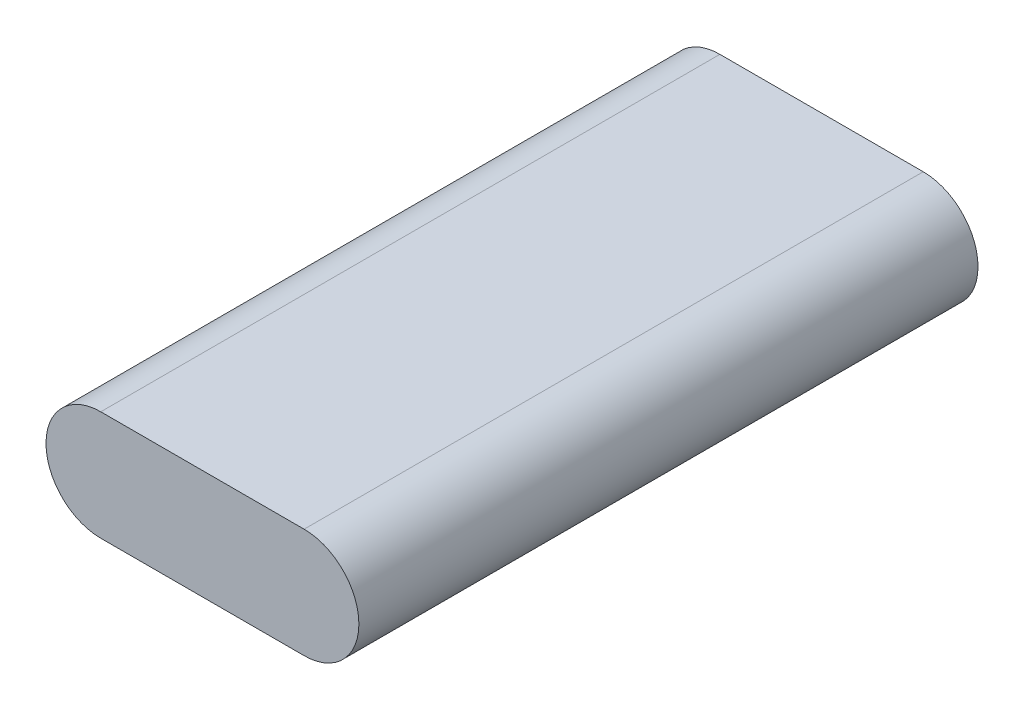
from build123d import *

# Parameters (mm, degrees)
BOSS_EXTRU_1_DEPTH = 130


with BuildPart() as part:
    # Esquisse2 → Boss.-Extru.1 (new body)
    with BuildSketch(Plane.XY):
        with BuildLine():
            Line((0, 1.456546612), (42.7, 1.456546612))
            ThreePointArc((42.7, 1.456546612), (54.2, -10.043453388), (42.7, -21.543453388))
            Line((42.7, -21.543453388), (0, -21.543453388))
            ThreePointArc((0, -21.543453388), (-11.5, -10.043453388), (0, 1.456546612))
        make_face()
    extrude(amount=BOSS_EXTRU_1_DEPTH)


solid = part.part
